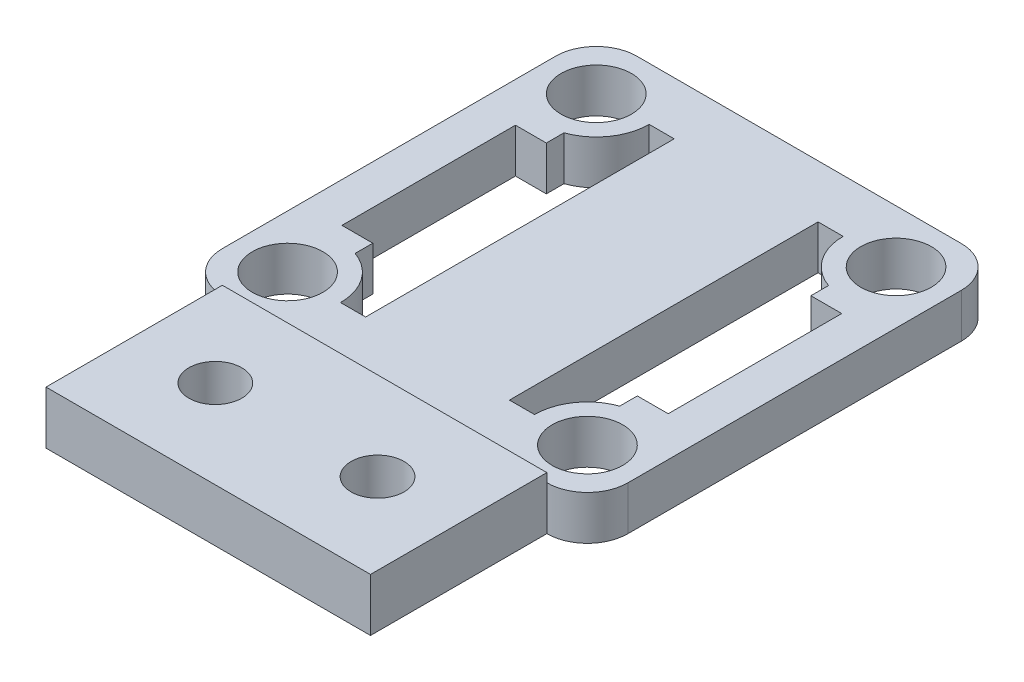
from build123d import *

# Parameters (mm, degrees)
BOSS_EXTRUDE1_DEPTH      = 2
CUT_EXTRUDE2_DEPTH       = 1
SKETCH5_R                = 2
CUT_EXTRUDE3_DEPTH       = 21.942838525
CUT_EXTRUDE4_DEPTH       = 21.942838525
SKETCH7_W                = 18.4
SKETCH7_H                = 1
BOSS_EXTRUDE2_DEPTH      = 10
SKETCH8_R                = 1.5
CUT_EXTRUDE5_DEPTH       = 25.092211634
CUT_EXTRUDE6_DEPTH       = 1
SKETCH11_W               = 1.421057218
SKETCH11_H               = 17.5
SKETCH11_W_2             = 1.75
SKETCH11_H_2             = 9.84
CUT_EXTRUDE7_DEPTH       = 25.092211634
BOSS_EXTRUDE3_START      = 2
BOSS_EXTRUDE3_DEPTH      = 2
CUT_EXTRUDE8_DEPTH       = 25.154392176
CUT_EXTRUDE8_DEPTH_BACK  = 25.154392176
CUT_EXTRUDE9_DEPTH       = 25.154392176
CUT_EXTRUDE9_DEPTH_BACK  = 25.154392176
CUT_EXTRUDE10_DEPTH      = 25.154392176
CUT_EXTRUDE10_DEPTH_BACK = 25.154392176
SKETCH15_R               = 1.5
CUT_EXTRUDE11_DEPTH      = 25.154392176
CUT_EXTRUDE11_DEPTH_BACK = 25.154392176
SKETCH16_R               = 1.5
CUT_EXTRUDE12_DEPTH      = 25.154392176
CUT_EXTRUDE12_DEPTH_BACK = 25.154392176
SKETCH17_R               = 2
BOSS_EXTRUDE4_START      = 1
BOSS_EXTRUDE4_DEPTH      = 1
CUT_EXTRUDE13_DEPTH      = 25.257672217
CUT_EXTRUDE13_DEPTH_BACK = 25.257672217
SKETCH19_R               = 2
CUT_EXTRUDE14_START      = -1.5
CUT_EXTRUDE14_DEPTH      = 1.5


with BuildPart() as part:
    # Sketch1 → Boss-Extrude1 (new body)
    with BuildSketch(Plane(origin=(0, 0, 0), x_dir=(1, 0, 0), z_dir=(0, 1, 0))):
        with BuildLine():
            Line((-12.649074074, 14.633101852), (5.750925926, 14.633101852))
            ThreePointArc((5.750925926, 14.633101852), (7.377271523, 13.959447449), (8.050925926, 12.333101852))
            Line((8.050925926, 12.333101852), (8.050925926, -6.566898148))
            ThreePointArc((8.050925926, -6.566898148), (7.377271523, -8.193243745), (5.750925926, -8.866898148))
            Line((5.750925926, -8.866898148), (-12.649074074, -8.866898148))
            ThreePointArc((-12.649074074, -8.866898148), (-14.275419671, -8.193243745), (-14.949074074, -6.566898148))
            Line((-14.949074074, -6.566898148), (-14.949074074, 12.333101852))
            ThreePointArc((-14.949074074, 12.333101852), (-14.275419671, 13.959447449), (-12.649074074, 14.633101852))
        make_face()
    extrude(amount=BOSS_EXTRUDE1_DEPTH)

    # Sketch2 → Cut-Extrude2 (cut)
    with BuildSketch(Plane(origin=(0, 2, 0), x_dir=(1, 0, 0), z_dir=(0, 1, 0))):
        with BuildLine():
            Line((5.750925926, 13.633101852), (-12.649074074, 13.633101852))
            ThreePointArc((-12.649074074, 13.633101852), (-13.56831289, 13.252340667), (-13.949074074, 12.333101852))
            Line((-13.949074074, 12.333101852), (-13.949074074, -6.566898148))
            ThreePointArc((-13.949074074, -6.566898148), (-13.56831289, -7.486136964), (-12.649074074, -7.866898148))
            Line((-12.649074074, -7.866898148), (5.750925926, -7.866898148))
            ThreePointArc((5.750925926, -7.866898148), (6.670164741, -7.486136964), (7.050925926, -6.566898148))
            Line((7.050925926, -6.566898148), (7.050925926, 12.333101852))
            ThreePointArc((7.050925926, 12.333101852), (6.670164741, 13.252340667), (5.750925926, 13.633101852))
        make_face()
    extrude(amount=-CUT_EXTRUDE2_DEPTH, mode=Mode.SUBTRACT)

    # Sketch5 → Cut-Extrude3 (cut, through all)
    with BuildSketch(Plane(origin=(0, 1, 0), x_dir=(1, 0, 0), z_dir=(0, 1, 0))):
        with Locations(Location((5.050925926, 11.633101852, 0), (0, 0, 270))):
            Circle(SKETCH5_R)
        with Locations(Location((5.050925926, -5.866898148, 0), (0, 0, 270))):
            Circle(SKETCH5_R)
        with Locations(Location((-11.949074074, -5.866898148, 0), (0, 0, 270))):
            Circle(SKETCH5_R)
        with Locations(Location((-11.949074074, 11.633101852, 0), (0, 0, 90))):
            Circle(SKETCH5_R)
    extrude(amount=-CUT_EXTRUDE3_DEPTH, mode=Mode.SUBTRACT)

    # Sketch6 → Cut-Extrude4 (cut, through all)
    with BuildSketch(Plane(origin=(0, 1, 0), x_dir=(1, 0, 0), z_dir=(0, 1, 0))):
        with BuildLine():
            Line((4.050925926, -3.038471023), (4.050925926, 8.804674727))
            ThreePointArc((4.050925926, 8.804674727), (2.601436183, 9.901051044), (2.050925926, 11.633101852))
            Line((2.050925926, 11.633101852), (2.050925926, -5.866898148))
            ThreePointArc((2.050925926, -5.866898148), (2.601436183, -4.134847341), (4.050925926, -3.038471023))
        make_face()
        with BuildLine():
            Line((-10.949074074, 8.804674727), (-10.949074074, -3.038471023))
            ThreePointArc((-10.949074074, -3.038471023), (-9.499584331, -4.134847341), (-8.949074074, -5.866898148))
            Line((-8.949074074, -5.866898148), (-8.949074074, 11.633101852))
            ThreePointArc((-8.949074074, 11.633101852), (-9.499584331, 9.901051044), (-10.949074074, 8.804674727))
        make_face()
    extrude(amount=-CUT_EXTRUDE4_DEPTH, mode=Mode.SUBTRACT)

    # Sketch7 → Boss-Extrude2 (add)
    with BuildSketch(Plane.XY.offset(8.866898148)):
        with Locations((-3.449074074, 0.5)):
            Rectangle(SKETCH7_W, SKETCH7_H)
    extrude(amount=BOSS_EXTRUDE2_DEPTH)

    # Sketch8 → Cut-Extrude5 (cut, through all)
    with BuildSketch(Plane(origin=(0, 1, 0), x_dir=(1, 0, 0), z_dir=(0, 1, 0))):
        with Locations(Location((1.150925926, -13.866898148, 0), (0, 0, 270))):
            Circle(SKETCH8_R)
        with Locations(Location((-8.049074074, -13.866898148, 0), (0, 0, 270))):
            Circle(SKETCH8_R)
    extrude(amount=-CUT_EXTRUDE5_DEPTH, mode=Mode.SUBTRACT)

    # Sketch9 → Cut-Extrude6 (cut)
    with BuildSketch(Plane(origin=(0, 2, 0), x_dir=(1, 0, 0), z_dir=(0, 1, 0))):
        with BuildLine():
            Line((5.750925926, 13.833101852), (-12.649074074, 13.833101852))
            ThreePointArc((-12.649074074, 13.833101852), (-13.709734246, 13.393762024), (-14.149074074, 12.333101852))
            Line((-14.149074074, 12.333101852), (-14.149074074, -6.566898148))
            ThreePointArc((-14.149074074, -6.566898148), (-13.709734246, -7.62755832), (-12.649074074, -8.066898148))
            Line((-12.649074074, -8.066898148), (5.750925926, -8.066898148))
            ThreePointArc((5.750925926, -8.066898148), (6.811586098, -7.62755832), (7.250925926, -6.566898148))
            Line((7.250925926, -6.566898148), (7.250925926, 12.333101852))
            ThreePointArc((7.250925926, 12.333101852), (6.811586098, 13.393762024), (5.750925926, 13.833101852))
        make_face()
    extrude(amount=-CUT_EXTRUDE6_DEPTH, mode=Mode.SUBTRACT)

    # Sketch11 → Cut-Extrude7 (cut, through all)
    with BuildSketch(Plane(origin=(0, 1, 0), x_dir=(1, 0, 0), z_dir=(0, 1, 0))):
        with Locations((-8.238545465, 2.883101852)):
            Rectangle(SKETCH11_W, SKETCH11_H)
        with Locations((1.340397317, 2.883101852)):
            Rectangle(SKETCH11_W, SKETCH11_H)
        with Locations((-11.824074074, 2.883101852)):
            Rectangle(SKETCH11_W_2, SKETCH11_H_2)
        with Locations((4.925925926, 2.883101852)):
            Rectangle(SKETCH11_W_2, SKETCH11_H_2)
    extrude(amount=-CUT_EXTRUDE7_DEPTH, mode=Mode.SUBTRACT)

    # Sketch12 → Boss-Extrude3 (add)
    with BuildSketch(Plane.XZ.offset(BOSS_EXTRUDE3_START)):
        with BuildLine():
            Line((8.050925926, -12.333101852), (8.050925926, 6.566898148))
            ThreePointArc((8.050925926, 6.566898148), (7.377271523, 8.193243745), (5.750925926, 8.866898148))
            Line((5.750925926, 8.866898148), (5.750925926, 18.866898148))
            Line((5.750925926, 18.866898148), (-12.649074074, 18.866898148))
            Line((-12.649074074, 18.866898148), (-12.649074074, 8.866898148))
            ThreePointArc((-12.649074074, 8.866898148), (-14.275419671, 8.193243745), (-14.949074074, 6.566898148))
            Line((-14.949074074, 6.566898148), (-14.949074074, -12.333101852))
            ThreePointArc((-14.949074074, -12.333101852), (-14.275419671, -13.959447449), (-12.649074074, -14.633101852))
            Line((-12.649074074, -14.633101852), (5.750925926, -14.633101852))
            ThreePointArc((5.750925926, -14.633101852), (7.377271523, -13.959447449), (8.050925926, -12.333101852))
        make_face()
    extrude(amount=-BOSS_EXTRUDE3_DEPTH)

    # Sketch13 → Cut-Extrude8 (cut, two sides: drawn at the far end of the back side and taken through both)
    with BuildSketch(Plane(origin=(0, 0, 0), x_dir=(1, 0, 0), z_dir=(0, 1, 0)).offset(-CUT_EXTRUDE8_DEPTH_BACK)):
        with BuildLine():
            Line((-12.699074074, 7.803101852), (-12.699074074, -2.036898148))
            Line((-12.699074074, -2.036898148), (-10.949074074, -2.036898148))
            Line((-10.949074074, -2.036898148), (-10.949074074, -3.038471023))
            ThreePointArc((-10.949074074, -3.038471023), (-9.499584331, -4.134847341), (-8.949074074, -5.866898148))
            Line((-8.949074074, -5.866898148), (-7.528016856, -5.866898148))
            Line((-7.528016856, -5.866898148), (-7.528016856, 11.633101852))
            Line((-7.528016856, 11.633101852), (-8.949074074, 11.633101852))
            ThreePointArc((-8.949074074, 11.633101852), (-9.499584331, 9.901051044), (-10.949074074, 8.804674727))
            Line((-10.949074074, 8.804674727), (-10.949074074, 7.803101852))
            Line((-10.949074074, 7.803101852), (-12.699074074, 7.803101852))
        make_face()
    extrude(amount=CUT_EXTRUDE8_DEPTH + CUT_EXTRUDE8_DEPTH_BACK, mode=Mode.SUBTRACT)

    # Sketch14 → Cut-Extrude9 (cut, two sides: drawn at the far end of the back side and taken through both)
    with BuildSketch(Plane(origin=(0, 0, 0), x_dir=(1, 0, 0), z_dir=(0, 1, 0)).offset(-CUT_EXTRUDE9_DEPTH_BACK)):
        with BuildLine():
            Line((0.629868708, -5.866898148), (2.050925926, -5.866898148))
            ThreePointArc((2.050925926, -5.866898148), (2.601436183, -4.134847341), (4.050925926, -3.038471023))
            Line((4.050925926, -3.038471023), (4.050925926, -2.036898148))
            Line((4.050925926, -2.036898148), (5.800925926, -2.036898148))
            Line((5.800925926, -2.036898148), (5.800925926, 7.803101852))
            Line((5.800925926, 7.803101852), (4.050925926, 7.803101852))
            Line((4.050925926, 7.803101852), (4.050925926, 8.804674727))
            ThreePointArc((4.050925926, 8.804674727), (2.601436183, 9.901051044), (2.050925926, 11.633101852))
            Line((2.050925926, 11.633101852), (0.629868708, 11.633101852))
            Line((0.629868708, 11.633101852), (0.629868708, -5.866898148))
        make_face()
    extrude(amount=CUT_EXTRUDE9_DEPTH + CUT_EXTRUDE9_DEPTH_BACK, mode=Mode.SUBTRACT)

    # Sketch15 → Cut-Extrude10 (cut, two sides: drawn at the far end of the back side and taken through both)
    with BuildSketch(Plane(origin=(0, 0, 0), x_dir=(1, 0, 0), z_dir=(0, 1, 0)).offset(-CUT_EXTRUDE10_DEPTH_BACK)):
        with Locations(Location((-8.049074074, -13.866898148, 0), (0, 0, 270))):
            Circle(SKETCH15_R)
    extrude(amount=CUT_EXTRUDE10_DEPTH + CUT_EXTRUDE10_DEPTH_BACK, mode=Mode.SUBTRACT)

    # Sketch16 → Cut-Extrude11 (cut, two sides: drawn at the far end of the back side and taken through both)
    with BuildSketch(Plane(origin=(0, 0, 0), x_dir=(1, 0, 0), z_dir=(0, 1, 0)).offset(-CUT_EXTRUDE11_DEPTH_BACK)):
        with Locations(Location((1.150925926, -13.866898148, 0), (0, 0, 270))):
            Circle(SKETCH16_R)
    extrude(amount=CUT_EXTRUDE11_DEPTH + CUT_EXTRUDE11_DEPTH_BACK, mode=Mode.SUBTRACT)

    # Sketch17 → Cut-Extrude12 (cut, two sides: drawn at the far end of the back side and taken through both)
    with BuildSketch(Plane(origin=(0, 0, 0), x_dir=(1, 0, 0), z_dir=(0, 1, 0)).offset(-CUT_EXTRUDE12_DEPTH_BACK)):
        with Locations(Location((-11.949074074, -5.866898148, 0), (0, 0, 270))):
            Circle(SKETCH17_R)
        with Locations(Location((5.050925926, -5.866898148, 0), (0, 0, 270))):
            Circle(SKETCH17_R)
        with Locations(Location((-11.949074074, 11.633101852, 0), (0, 0, 270))):
            Circle(SKETCH17_R)
        with Locations(Location((5.050925926, 11.633101852, 0), (0, 0, 270))):
            Circle(SKETCH17_R)
    extrude(amount=CUT_EXTRUDE12_DEPTH + CUT_EXTRUDE12_DEPTH_BACK, mode=Mode.SUBTRACT)

    # Sketch18 → Boss-Extrude4 (add)
    with BuildSketch(Plane(origin=(0, 1, 0), x_dir=(1, 0, 0), z_dir=(0, 1, 0)).offset(BOSS_EXTRUDE4_START)):
        with BuildLine():
            Line((5.750925926, 13.833101852), (-12.649074074, 13.833101852))
            ThreePointArc((-12.649074074, 13.833101852), (-13.709734246, 13.393762024), (-14.149074074, 12.333101852))
            Line((-14.149074074, 12.333101852), (-14.149074074, -6.566898148))
            ThreePointArc((-14.149074074, -6.566898148), (-13.709734246, -7.62755832), (-12.649074074, -8.066898148))
            Line((-12.649074074, -8.066898148), (5.750925926, -8.066898148))
            ThreePointArc((5.750925926, -8.066898148), (6.811586098, -7.62755832), (7.250925926, -6.566898148))
            Line((7.250925926, -6.566898148), (7.250925926, 12.333101852))
            ThreePointArc((7.250925926, 12.333101852), (6.811586098, 13.393762024), (5.750925926, 13.833101852))
        make_face()
    extrude(amount=-BOSS_EXTRUDE4_DEPTH)

    # Sketch19 → Cut-Extrude13 (cut, two sides: drawn at the far end of the back side and taken through both)
    with BuildSketch(Plane.XZ.offset(-1).offset(-CUT_EXTRUDE13_DEPTH_BACK)):
        with Locations(Location((5.050925926, -11.633101852, 0), (0, 0, 90))):
            Circle(SKETCH19_R)
        with Locations(Location((-11.949074074, -11.633101852, 0), (0, 0, 90))):
            Circle(SKETCH19_R)
        with Locations(Location((-11.949074074, 5.866898148, 0), (0, 0, 90))):
            Circle(SKETCH19_R)
        with Locations(Location((5.050925926, 5.866898148, 0), (0, 0, 90))):
            Circle(SKETCH19_R)
        with BuildLine():
            Line((-10.949074074, 3.038471023), (-10.949074074, 2.036898148))
            Line((-10.949074074, 2.036898148), (-12.699074074, 2.036898148))
            Line((-12.699074074, 2.036898148), (-12.699074074, -7.803101852))
            Line((-12.699074074, -7.803101852), (-10.949074074, -7.803101852))
            Line((-10.949074074, -7.803101852), (-10.949074074, -8.804674727))
            ThreePointArc((-10.949074074, -8.804674727), (-9.499584331, -9.901051044), (-8.949074074, -11.633101852))
            Line((-8.949074074, -11.633101852), (-7.528016856, -11.633101852))
            Line((-7.528016856, -11.633101852), (-7.528016856, 5.866898148))
            Line((-7.528016856, 5.866898148), (-8.949074074, 5.866898148))
            ThreePointArc((-8.949074074, 5.866898148), (-9.499584331, 4.134847341), (-10.949074074, 3.038471023))
        make_face()
        with BuildLine():
            Line((4.050925926, 2.036898148), (4.050925926, 3.038471023))
            ThreePointArc((4.050925926, 3.038471023), (2.601436183, 4.134847341), (2.050925926, 5.866898148))
            Line((2.050925926, 5.866898148), (0.629868708, 5.866898148))
            Line((0.629868708, 5.866898148), (0.629868708, -11.633101852))
            Line((0.629868708, -11.633101852), (2.050925926, -11.633101852))
            ThreePointArc((2.050925926, -11.633101852), (2.601436183, -9.901051044), (4.050925926, -8.804674727))
            Line((4.050925926, -8.804674727), (4.050925926, -7.803101852))
            Line((4.050925926, -7.803101852), (5.800925926, -7.803101852))
            Line((5.800925926, -7.803101852), (5.800925926, 2.036898148))
            Line((5.800925926, 2.036898148), (4.050925926, 2.036898148))
        make_face()
    extrude(amount=CUT_EXTRUDE13_DEPTH + CUT_EXTRUDE13_DEPTH_BACK, mode=Mode.SUBTRACT)

    # Sketch20 → Cut-Extrude14 (cut)
    with BuildSketch(Plane(origin=(0, 2, 0), x_dir=(1, 0, 0), z_dir=(0, 1, 0)).offset(CUT_EXTRUDE14_START)):
        with BuildLine():
            Line((5.750925926, 14.633101852), (-12.649074074, 14.633101852))
            ThreePointArc((-12.649074074, 14.633101852), (-14.275419671, 13.959447449), (-14.949074074, 12.333101852))
            Line((-14.949074074, 12.333101852), (-14.949074074, -6.566898148))
            ThreePointArc((-14.949074074, -6.566898148), (-14.275419671, -8.193243745), (-12.649074074, -8.866898148))
            Line((-12.649074074, -8.866898148), (5.750925926, -8.866898148))
            ThreePointArc((5.750925926, -8.866898148), (7.377271523, -8.193243745), (8.050925926, -6.566898148))
            Line((8.050925926, -6.566898148), (8.050925926, 12.333101852))
            ThreePointArc((8.050925926, 12.333101852), (7.377271523, 13.959447449), (5.750925926, 14.633101852))
        make_face()
    extrude(amount=CUT_EXTRUDE14_DEPTH, mode=Mode.SUBTRACT)


solid = part.part
